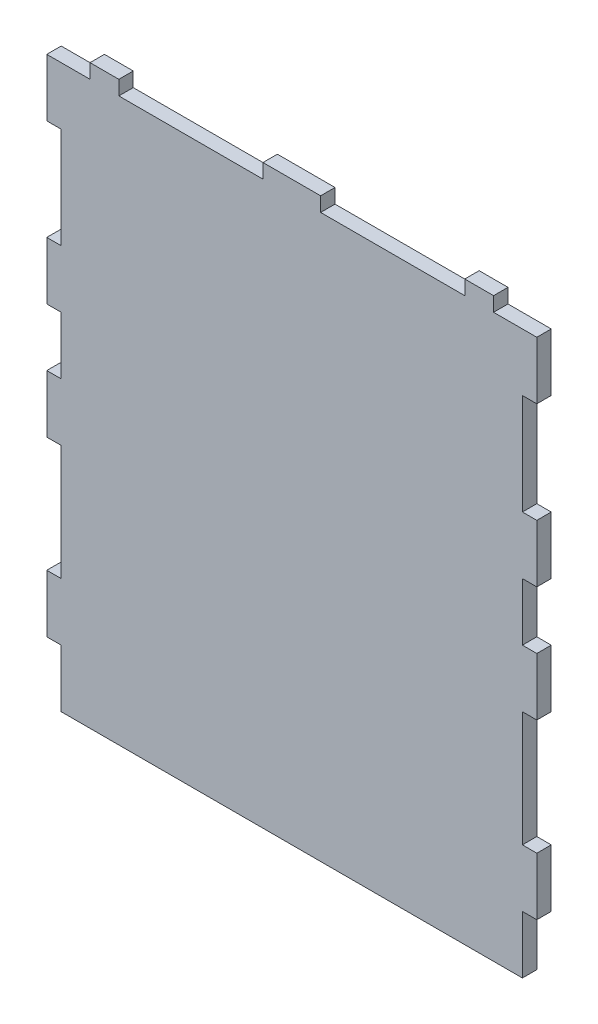
from build123d import *

# Parameters (mm, degrees)
BOSS_EXTRUDE1_DEPTH = 2.5


with BuildPart() as part:
    # Sketch1 → Boss-Extrude1 (new body)
    with BuildSketch(Plane.XY):
        Polygon((10, 97.5), (35, 97.5), (35, 100), (45, 100), (45, 97.5), (70, 97.5), (70, 100), (75, 100), (75, 97.5), (80, 97.5), (82.5, 97.5), (82.5, 87.5), (80, 87.5), (80, 70), (82.5, 70), (82.5, 60), (80, 60), (80, 50), (82.5, 50), (82.5, 40), (80, 40), (80, 20), (82.5, 20), (82.5, 10), (80, 10), (80, 0), (0, 0), (0, 10), (-2.5, 10), (-2.5, 20), (0, 20), (0, 40), (-2.5, 40), (-2.5, 50), (0, 50), (0, 60), (-2.5, 60), (-2.5, 70), (0, 70), (0, 87.5), (-2.5, 87.5), (-2.5, 97.5), (0, 97.5), (5, 97.5), (5, 100), (10, 100), align=None)
    extrude(amount=BOSS_EXTRUDE1_DEPTH)


solid = part.part
